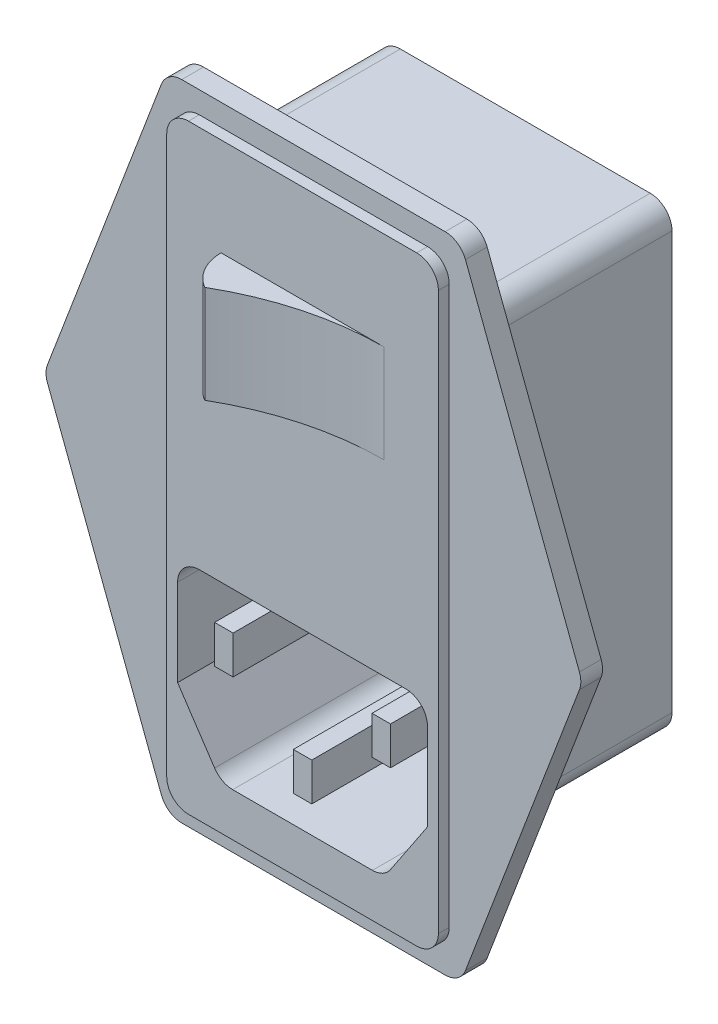
from build123d import *

# Parameters (mm, degrees)
EXTRUDE_1_DEPTH     = 17.5
EXTRUDE_2_DEPTH     = 2
SKETCH_3_W          = 25
SKETCH_3_H          = 55.25
EXTRUDE_3_DEPTH     = 1
FILLET_1_R          = 2
FILLET_2_R          = 2
FILLET_3_R          = 2
SKETCH_4_W          = 15
SKETCH_4_H          = 9
EXTRUDE_4_DEPTH     = 3.5
CUT_EXTRUDE_1_DEPTH = 9
SKETCH_6_W          = 1.7
SKETCH_6_H          = 3.5
CUT_EXTRUDE_2_DEPTH = 18
FILLET_4_R          = 2
CUT_EXTRUDE_3_DEPTH = 7
SKETCH_8_W          = 5
SKETCH_8_H          = 1
EXTRUDE_5_DEPTH     = 9.5
SKETCH_9_W          = 1
SKETCH_9_H          = 5
EXTRUDE_6_DEPTH     = 7


with BuildPart() as part:
    # Эскиз1 → Бобышка-Вытянуть1 (new body)
    with BuildSketch(Plane.XY):
        Polygon((0, 0), (27, 0), (27, -41.25), (20.75, -47.25), (6.25, -47.25), (0, -41.25), align=None)
    extrude(amount=EXTRUDE_1_DEPTH)

    # Эскиз2 → Бобышка-Вытянуть2 (add)
    with BuildSketch(Plane.XY.offset(17.5)):
        Polygon((0, 7), (27, 7), (38.25, -22.625), (27, -52.25), (0, -52.25), (-11.25, -22.625), align=None)
    extrude(amount=EXTRUDE_2_DEPTH)

    # Эскиз3 → Бобышка-Вытянуть3 (add)
    with BuildSketch(Plane.XY.offset(19.5)):
        with Locations((13.5, -22.625)):
            Rectangle(SKETCH_3_W, SKETCH_3_H)
    extrude(amount=EXTRUDE_3_DEPTH)

    # Скругление1
    fillet_1_edges = [part.edges().sort_by_distance(p)[0] for p in [
        (0, 7, 18.5),
        (27, -52.25, 18.5),
        (38.25, -22.625, 18.5),
        (27, 7, 18.5),
    ]]
    fillet(fillet_1_edges, radius=FILLET_1_R)

    # Скругление2
    fillet_2_edges = [part.edges().sort_by_distance(p)[0] for p in [
        (-11.25, -22.625, 18.5),
        (0, -52.25, 18.5),
    ]]
    fillet(fillet_2_edges, radius=FILLET_2_R)

    # Скругление3
    fillet_3_edges = [part.edges().sort_by_distance(p)[0] for p in [
        (1, 5, 20),
        (1, -50.25, 20),
        (26, -50.25, 20),
        (26, 5, 20),
    ]]
    fillet(fillet_3_edges, radius=FILLET_3_R)

    # Эскиз4 → Бобышка-Вытянуть4 (add)
    with BuildSketch(Plane.XY.offset(20.5)):
        with Locations((13.5, -8.5)):
            Rectangle(SKETCH_4_W, SKETCH_4_H)
    extrude(amount=EXTRUDE_4_DEPTH)

    # Эскиз5 → Вырез-Вытянуть1 (cut)
    with BuildSketch(Plane(origin=(0, -4, 0), x_dir=(1, 0, 0), z_dir=(0, 1, 0))):
        with BuildLine():
            ThreePointArc((21, -20.5), (14.268543991, -21.390306253), (8, -24))
            Line((8, -24), (21, -24))
            Line((21, -24), (21, -20.5))
        make_face()
        with BuildLine():
            Line((6, -20.5), (6, -24))
            Line((6, -24), (8, -24))
            ThreePointArc((8, -24), (6.535262235, -22.515564437), (6, -20.5))
        make_face()
    extrude(amount=-CUT_EXTRUDE_1_DEPTH, mode=Mode.SUBTRACT)

    # Эскиз6 → Вырез-Вытянуть2 (cut)
    with BuildSketch(Plane.XY.offset(20.5)):
        with BuildLine():
            Line((4, -30.25), (23, -30.25))
            ThreePointArc((23, -30.25), (24.414213562, -30.835786438), (25, -32.25))
            Line((25, -32.25), (25, -40.25))
            Line((25, -40.25), (21.593733072, -45.359400392))
            ThreePointArc((21.593733072, -45.359400392), (20.873348334, -46.013349198), (19.929632483, -46.25))
            Line((19.929632483, -46.25), (7.070367517, -46.25))
            ThreePointArc((7.070367517, -46.25), (6.126651666, -46.013349198), (5.406266928, -45.359400392))
            Line((5.406266928, -45.359400392), (2, -40.25))
            Line((2, -40.25), (2, -32.25))
            ThreePointArc((2, -32.25), (2.585786438, -30.835786438), (4, -30.25))
        make_face()
        with Locations((6.256266928, -35.5)):
            Rectangle(SKETCH_6_W, SKETCH_6_H, mode=Mode.SUBTRACT)
        with Locations((20.743733072, -35.5)):
            Rectangle(SKETCH_6_W, SKETCH_6_H, mode=Mode.SUBTRACT)
        with Locations((13.5, -42)):
            Rectangle(SKETCH_6_W, SKETCH_6_H, mode=Mode.SUBTRACT)
    extrude(amount=-CUT_EXTRUDE_2_DEPTH, mode=Mode.SUBTRACT)

    # Скругление4
    fillet_4_edges = [part.edges().sort_by_distance(p)[0] for p in [
        (0, 0, 8.75),
        (27, 0, 8.75),
        (27, -41.25, 8.75),
        (20.75, -47.25, 8.75),
        (6.25, -47.25, 8.75),
        (0, -41.25, 8.75),
    ]]
    fillet(fillet_4_edges, radius=FILLET_4_R)

    # Эскиз7 → Вырез-Вытянуть3 (cut)
    with BuildSketch(Plane(origin=(0, 0, 0), x_dir=(-1, 0, 0), z_dir=(0, 0, -1))):
        with BuildLine():
            Line((-23.5, -1.5), (-3.5, -1.5))
            ThreePointArc((-3.5, -1.5), (-2.085786438, -2.085786438), (-1.5, -3.5))
            Line((-1.5, -3.5), (-1.5, -14.5))
            ThreePointArc((-1.5, -14.5), (-2.085786438, -15.914213562), (-3.5, -16.5))
            Line((-3.5, -16.5), (-23.5, -16.5))
            ThreePointArc((-23.5, -16.5), (-24.914213562, -15.914213562), (-25.5, -14.5))
            Line((-25.5, -14.5), (-25.5, -3.5))
            ThreePointArc((-25.5, -3.5), (-24.914213562, -2.085786438), (-23.5, -1.5))
        make_face()
    extrude(amount=-CUT_EXTRUDE_3_DEPTH, mode=Mode.SUBTRACT)

    # Эскиз8 → Бобышка-Вытянуть5 (add)
    with BuildSketch(Plane(origin=(0, 0, 0), x_dir=(-1, 0, 0), z_dir=(0, 0, -1))):
        with Locations((-4.5, -20)):
            Rectangle(SKETCH_8_W, SKETCH_8_H)
        with Locations((-4.5, -33)):
            Rectangle(SKETCH_8_W, SKETCH_8_H)
        with Locations((-13.5, -43.75)):
            Rectangle(SKETCH_8_W, SKETCH_8_H)
    extrude(amount=EXTRUDE_5_DEPTH)

    # Эскиз9 → Бобышка-Вытянуть6 (add)
    with BuildSketch(Plane(origin=(0, 0, 7), x_dir=(-1, 0, 0), z_dir=(0, 0, -1))):
        with Locations((-7, -9)):
            Rectangle(SKETCH_9_W, SKETCH_9_H)
        with Locations((-14, -9)):
            Rectangle(SKETCH_9_W, SKETCH_9_H)
    extrude(amount=EXTRUDE_6_DEPTH)


solid = part.part
